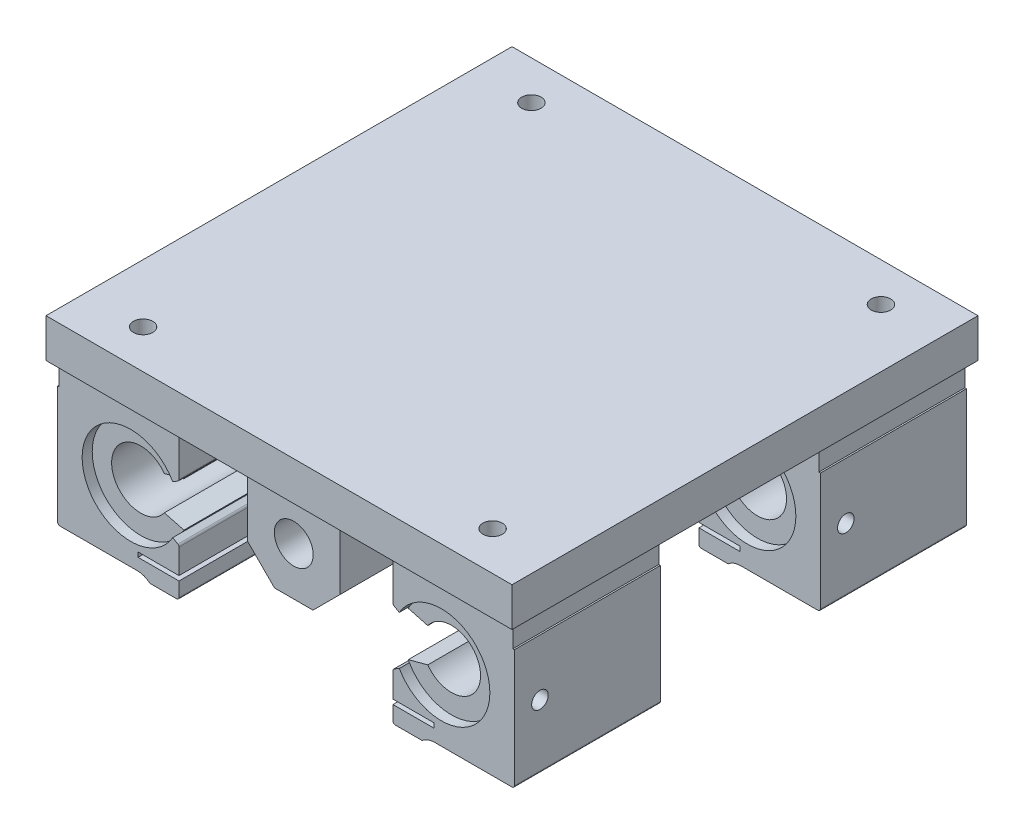
from build123d import *

# Parameters (mm, degrees)
SKETCH2_W          = 152.4
SKETCH2_H          = 12.7
EXTRUDE1_DEPTH     = 76.2
EXTRUDE2_DEPTH     = 47.752
SKETCH23_R         = 3.175
CUT_EXTRUDE1_DEPTH = 12.7
SKETCH29_R         = 2.7051
CUT_EXTRUDE6_DEPTH = 12.7
SKETCH24_R         = 7.9375
EXTRUDE4_DEPTH     = 38.1
EXTRUDE5_DEPTH     = 41.148
EXTRUDE6_START     = -41.148
EXTRUDE6_DEPTH     = 41.148
SKETCH33_R         = 1.5875
SKETCH33_R_2       = 2.0193
CUT_EXTRUDE7_DEPTH = 3.302
SKETCH34_R         = 7.9375
SKETCH34_R_2       = 6.35
EXTRUDE7_DEPTH     = 38.1


with BuildPart() as part:
    # Sketch2 → Extrude1 (new, symmetric)
    with BuildSketch(Plane.XY):
        with Locations((0, 22.5298)):
            Rectangle(SKETCH2_W, SKETCH2_H)
    extrude(amount=EXTRUDE1_DEPTH, both=True)

    # Sketch22 → Extrude2 (add)
    with BuildSketch(Plane.XY.offset(73.914)):
        with BuildLine():
            Line((-74.168, 8.5598), (-74.676, 8.5598))
            Line((-74.676, 8.5598), (-74.676, -29.9466))
            ThreePointArc((-74.676, -29.9466), (-74.452815367, -30.485415367), (-73.914, -30.7086))
            Line((-73.914, -30.7086), (-48.64051151, -30.7086))
            ThreePointArc((-48.64051151, -30.7086), (-46.440806984, -31.101771985), (-44.5135, -32.2326))
            Line((-44.5135, -32.2326), (-35.7505, -32.2326))
            ThreePointArc((-35.7505, -32.2326), (-35.211684633, -32.009415367), (-34.9885, -31.4706))
            Line((-34.9885, -31.4706), (-34.9885, -26.797))
            Line((-34.9885, -26.797), (-48.387, -26.797))
            Line((-48.387, -26.797), (-48.387, -25.273))
            Line((-48.387, -25.273), (-34.9885, -25.273))
            Line((-34.9885, -25.273), (-34.9885, -17.188714686))
            ThreePointArc((-34.9885, -17.188714686), (-35.090588642, -16.807714686), (-35.3695, -16.528803329))
            Line((-35.3695, -16.528803329), (-37.051846715, -15.5575))
            ThreePointArc((-37.051846715, -15.5575), (-66.675, -7.62), (-37.051846715, 0.3175))
            Line((-37.051846715, 0.3175), (-35.3695, 1.288803329))
            ThreePointArc((-35.3695, 1.288803329), (-35.090588642, 1.567714686), (-34.9885, 1.948714686))
            Line((-34.9885, 1.948714686), (-34.9885, 15.4178))
            ThreePointArc((-34.9885, 15.4178), (-35.211684633, 15.956615367), (-35.7505, 16.1798))
            Line((-35.7505, 16.1798), (-74.168, 16.1798))
            Line((-74.168, 16.1798), (-74.168, 8.5598))
        make_face()
        with BuildLine():
            Line((37.051846715, -15.5575), (35.3695, -16.528803329))
            ThreePointArc((35.3695, -16.528803329), (35.090588642, -16.807714686), (34.9885, -17.188714686))
            Line((34.9885, -17.188714686), (34.9885, -25.273))
            Line((34.9885, -25.273), (48.387, -25.273))
            Line((48.387, -25.273), (48.387, -26.797))
            Line((48.387, -26.797), (34.9885, -26.797))
            Line((34.9885, -26.797), (34.9885, -31.4706))
            ThreePointArc((34.9885, -31.4706), (35.211684633, -32.009415367), (35.7505, -32.2326))
            Line((35.7505, -32.2326), (44.5135, -32.2326))
            ThreePointArc((44.5135, -32.2326), (46.440806984, -31.101771985), (48.64051151, -30.7086))
            Line((48.64051151, -30.7086), (73.914, -30.7086))
            ThreePointArc((73.914, -30.7086), (74.452815367, -30.485415367), (74.676, -29.9466))
            Line((74.676, -29.9466), (74.676, 8.5598))
            Line((74.676, 8.5598), (74.168, 8.5598))
            Line((74.168, 8.5598), (74.168, 16.1798))
            Line((74.168, 16.1798), (35.7505, 16.1798))
            ThreePointArc((35.7505, 16.1798), (35.211684633, 15.956615367), (34.9885, 15.4178))
            Line((34.9885, 15.4178), (34.9885, 1.948714686))
            ThreePointArc((34.9885, 1.948714686), (35.090588642, 1.567714686), (35.3695, 1.288803329))
            Line((35.3695, 1.288803329), (37.051846715, 0.3175))
            ThreePointArc((37.051846715, 0.3175), (66.675, -7.62), (37.051846715, -15.5575))
        make_face()
    extrude2 = extrude(amount=-EXTRUDE2_DEPTH)

    # Mirror2: Extrude2 across plane
    add(extrude2.mirror(Plane.XY))

    # Sketch23 → Cut-Extrude1 (cut)
    with BuildSketch(Plane(origin=(5.367656622, 28.8798, -305.813781018), x_dir=(-1, 0, 0), z_dir=(0, 1, 0))):
        with Locations((62.517656622, 369.313781018)):
            Circle(SKETCH23_R)
        with Locations((62.517656622, 242.313781018)):
            Circle(SKETCH23_R)
        with Locations((-51.782343378, 242.313781018)):
            Circle(SKETCH23_R)
        with Locations((-51.782343378, 369.313781018)):
            Circle(SKETCH23_R)
    extrude(amount=-CUT_EXTRUDE1_DEPTH, mode=Mode.SUBTRACT)

    # Sketch29 → Cut-Extrude6 (cut)
    with BuildSketch(Plane.ZY.offset(74.676)):
        with Locations((65.532, -9.8298)):
            Circle(SKETCH29_R)
        with Locations((-34.4932, -9.8298)):
            Circle(SKETCH29_R)
    cut_extrude6 = extrude(amount=-CUT_EXTRUDE6_DEPTH, mode=Mode.SUBTRACT)

    # Mirror1: Cut-Extrude6 across plane
    add(cut_extrude6.mirror(Plane(origin=(0, 0, 0), x_dir=(0, 0, 1), z_dir=(1, 0, 0))), mode=Mode.SUBTRACT)

    # Sketch30 → Extrude5 (add)
    with BuildSketch(Plane.XY.offset(70.612)):
        with BuildLine():
            Line((36.685094723, -14.885333717), (43.063481989, -13.17625))
            ThreePointArc((43.063481989, -13.17625), (60.325, -7.62), (43.063481989, -2.06375))
            Line((43.063481989, -2.06375), (36.685094723, -0.354666283))
            ThreePointArc((36.685094723, -0.354666283), (66.675, -7.62), (36.685094723, -14.885333717))
        make_face()
        with BuildLine():
            Line((-43.063481989, -2.06375), (-36.685094723, -0.354666283))
            ThreePointArc((-36.685094723, -0.354666283), (-66.675, -7.62), (-36.685094723, -14.885333717))
            Line((-36.685094723, -14.885333717), (-43.063481989, -13.17625))
            ThreePointArc((-43.063481989, -13.17625), (-60.325, -7.62), (-43.063481989, -2.06375))
        make_face()
    extrude(amount=-EXTRUDE5_DEPTH)

    # Sketch32 → Extrude6 (add)
    with BuildSketch(Plane(origin=(0, 0, -70.612), x_dir=(-1, 0, 0), z_dir=(0, 0, -1)).offset(EXTRUDE6_START)):
        with BuildLine():
            Line((-43.063481989, -2.06375), (-36.685094723, -0.354666283))
            ThreePointArc((-36.685094723, -0.354666283), (-36.864417487, -0.016371589), (-37.051846715, 0.3175))
            ThreePointArc((-37.051846715, 0.3175), (-66.675, -7.62), (-37.051846715, -15.5575))
            ThreePointArc((-37.051846715, -15.5575), (-36.864417487, -15.223628411), (-36.685094723, -14.885333717))
            Line((-36.685094723, -14.885333717), (-43.063481989, -13.17625))
            ThreePointArc((-43.063481989, -13.17625), (-60.325, -7.62), (-43.063481989, -2.06375))
        make_face()
        with BuildLine():
            Line((43.063481989, -13.17625), (36.685094723, -14.885333717))
            ThreePointArc((36.685094723, -14.885333717), (36.864417487, -15.223628411), (37.051846715, -15.5575))
            ThreePointArc((37.051846715, -15.5575), (66.675, -7.62), (37.051846715, 0.3175))
            ThreePointArc((37.051846715, 0.3175), (36.864417487, -0.016371589), (36.685094723, -0.354666283))
            Line((36.685094723, -0.354666283), (43.063481989, -2.06375))
            ThreePointArc((43.063481989, -2.06375), (60.325, -7.62), (43.063481989, -13.17625))
        make_face()
    extrude(amount=EXTRUDE6_DEPTH)

    # Sketch33 → Cut-Extrude7 (cut)
    with BuildSketch(Plane.XZ.offset(32.2326)):
        with Locations((50.8, 67.5386)):
            Circle(SKETCH33_R)
        with Locations((39.751, 50.0126)):
            Circle(SKETCH33_R_2)
        with Locations((-50.8, 32.4866)):
            Circle(SKETCH33_R)
        with Locations((-39.751, 50.0126)):
            Circle(SKETCH33_R_2)
        with Locations((50.8, -32.5374)):
            Circle(SKETCH33_R)
        with Locations((39.751, -50.0634)):
            Circle(SKETCH33_R_2)
        with Locations((-50.8, -67.5386)):
            Circle(SKETCH33_R)
        with Locations((-39.751, -50.0126)):
            Circle(SKETCH33_R_2)
    extrude(amount=-CUT_EXTRUDE7_DEPTH, mode=Mode.SUBTRACT)


with BuildPart() as body_2:
    # Sketch24 → Extrude4 (new body)
    with BuildSketch(Plane.XY.offset(71.374)):
        Polygon((-15.1765, 16.1798), (15.1765, 16.1798), (15.1765, -6.8072), (6.2865, -15.6972), (-6.2865, -15.6972), (-15.1765, -6.8072), align=None)
        Circle(SKETCH24_R, mode=Mode.SUBTRACT)
    extrude(amount=-EXTRUDE4_DEPTH)


with BuildPart() as part_1:
    add(part.part)

    # Combine1: union body 2
    add(body_2.part)

    # Sketch34 → Extrude7 (add)
    with BuildSketch(Plane.XY.offset(71.374)):
        Circle(SKETCH34_R)
        Circle(SKETCH34_R_2, mode=Mode.SUBTRACT)
    extrude(amount=-EXTRUDE7_DEPTH)


solid = part_1.part
